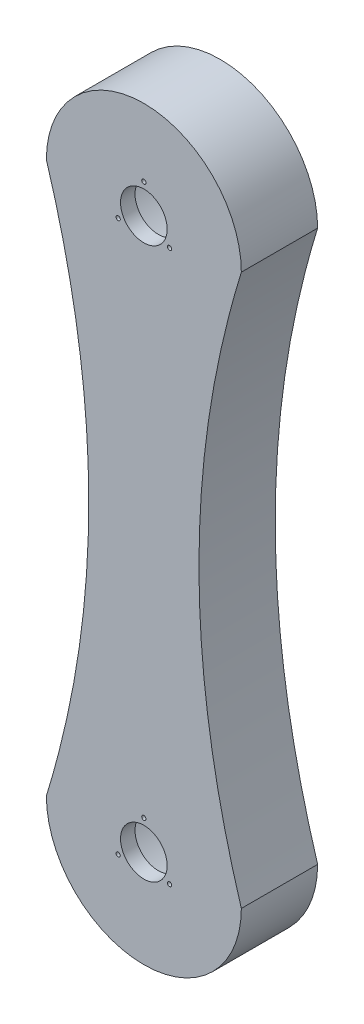
from build123d import *

# Parameters (mm, degrees)
BOSS_EXTRUDE1_DEPTH = 90
SKETCH2_R           = 97.5
CUT_EXTRUDE1_DEPTH  = 72.91
SKETCH4_R           = 2.5
CUT_EXTRUDE3_DEPTH  = 20
SKETCH3_R           = 27.5
CUT_EXTRUDE4_DEPTH  = 20
CIRPATTERN2_COUNT   = 3
SKETCH6_R           = 97.5
CUT_EXTRUDE5_DEPTH  = 72.91
SKETCH7_R           = 27.5
CUT_EXTRUDE6_DEPTH  = 72.91
SKETCH8_R           = 2.5
SKETCH8_R_2         = 27.5
CUT_EXTRUDE7_DEPTH  = 72.91


with BuildPart() as part:
    # Sketch1 → Boss-Extrude1 (new body)
    with BuildSketch(Plane(origin=(0, 0, 0), x_dir=(0, 1, 0), z_dir=(0, 0, 1))):
        with BuildLine():
            ThreePointArc((0, 115), (-115, 0), (0, -115))
            add(Edge.make_bspline(
                [(0, -115), (325, -15), (650, -115)],
                knots=[0, 0, 0, 1, 1, 1], degree=2))
            ThreePointArc((650, -115), (765, 0), (650, 115))
            add(Edge.make_bspline(
                [(0, 115), (325, 15), (650, 115)],
                knots=[0, 0, 0, 1, 1, 1], degree=2))
        make_face()
    extrude(amount=BOSS_EXTRUDE1_DEPTH)

    # Sketch2 → Cut-Extrude1 (cut)
    with BuildSketch(Plane(origin=(0, 0, 0), x_dir=(1, 0, 0), z_dir=(0, 0, -1))):
        with Locations(Location((0, 0, 0), (0, 0, 180))):
            Circle(SKETCH2_R)
    extrude(amount=-CUT_EXTRUDE1_DEPTH, mode=Mode.SUBTRACT)

    # Sketch4 → Cut-Extrude3 (cut)
    with BuildSketch(Plane.XY.offset(90)):
        with Locations((0, 35)):
            Circle(SKETCH4_R)
    cut_extrude3 = extrude(amount=-CUT_EXTRUDE3_DEPTH, mode=Mode.SUBTRACT)

    # Sketch3 → Cut-Extrude4 (cut)
    with BuildSketch(Plane(origin=(0, 0, 72.91), x_dir=(1, 0, 0), z_dir=(0, 0, -1))):
        with Locations(Location((0, 0, 0), (0, 0, 180))):
            Circle(SKETCH3_R)
    extrude(amount=-CUT_EXTRUDE4_DEPTH, mode=Mode.SUBTRACT)

    # CirPattern2: Cut-Extrude3 ×3 about axis
    cirpattern2_axis = Axis((0, 0, 0), (0, 0, 1))
    for i in range(1, CIRPATTERN2_COUNT):
        add(cut_extrude3.rotate(cirpattern2_axis, i * 360 / CIRPATTERN2_COUNT), mode=Mode.SUBTRACT)

    # Sketch6 → Cut-Extrude5 (cut)
    with BuildSketch(Plane(origin=(0, 0, 0), x_dir=(1, 0, 0), z_dir=(0, 0, -1))):
        with Locations(Location((0, -650, 0), (0, 0, 180))):
            Circle(SKETCH6_R)
    extrude(amount=-CUT_EXTRUDE5_DEPTH, mode=Mode.SUBTRACT)

    # Sketch7 → Cut-Extrude6 (cut)
    with BuildSketch(Plane(origin=(0, 0, 72.91), x_dir=(1, 0, 0), z_dir=(0, 0, -1))):
        with Locations(Location((0, -650, 0), (0, 0, 180))):
            Circle(SKETCH7_R)
    extrude(amount=-CUT_EXTRUDE6_DEPTH, mode=Mode.SUBTRACT)

    # Sketch8 → Cut-Extrude7 (cut)
    with BuildSketch(Plane.XY.offset(90)):
        with Locations((-30.310889132, 632.5)):
            Circle(SKETCH8_R)
        with Locations((0, 685)):
            Circle(SKETCH8_R)
        with Locations((30.310889132, 632.5)):
            Circle(SKETCH8_R)
        with Locations(Location((30.310889132, -17.5, 0), (0, 0, 240))):
            Circle(SKETCH8_R)
        with Locations((0, 35)):
            Circle(SKETCH8_R)
        with Locations(Location((-30.310889132, -17.5, 0), (0, 0, 120))):
            Circle(SKETCH8_R)
        with Locations(Location((0, 650, 0), (0, 0, 180))):
            Circle(SKETCH8_R_2)
    extrude(amount=-CUT_EXTRUDE7_DEPTH, mode=Mode.SUBTRACT)


solid = part.part
